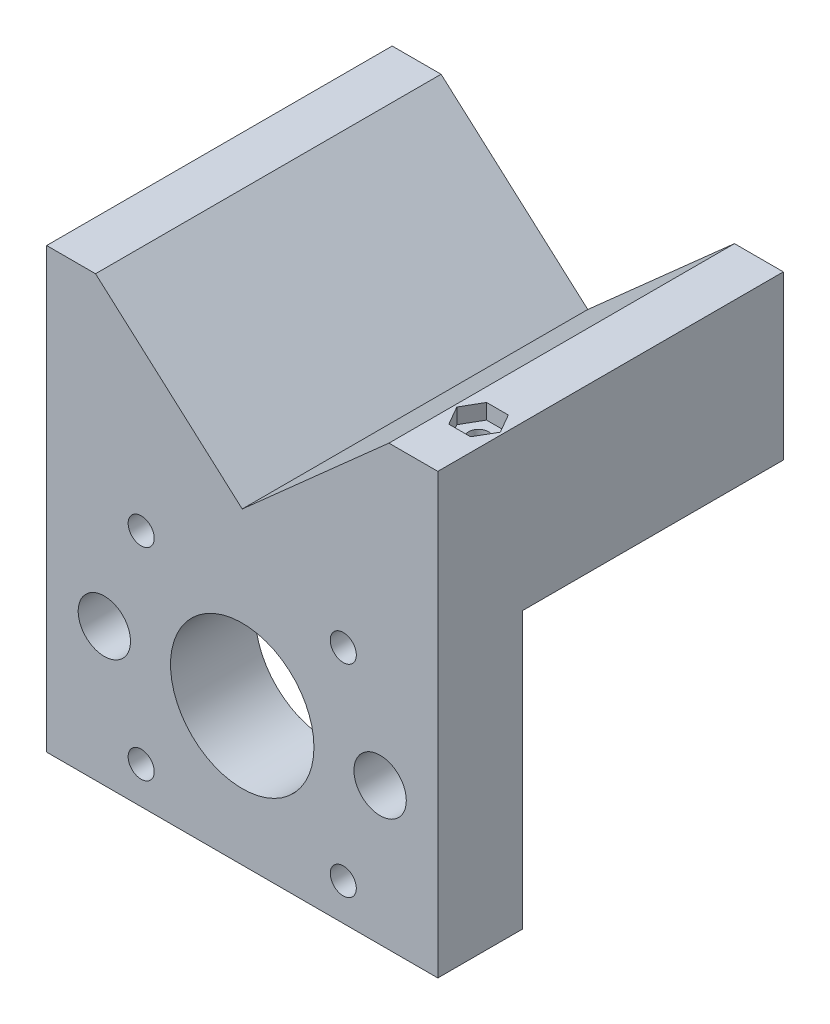
from build123d import *

# Parameters (mm, degrees)
SKETCH2_W           = 60
SKETCH2_H           = 42.3
BOSS_EXTRUDE1_DEPTH = 13
SKETCH4_R           = 11
SKETCH4_R_2         = 2
CUT_EXTRUDE1_DEPTH  = 48.598760453
SKETCH5_R           = 4.015
CUT_EXTRUDE2_DEPTH  = 10
BOSS_EXTRUDE2_DEPTH = 53
CUT_EXTRUDE3_DEPTH  = 2.35
SKETCH8_R           = 1.5
CUT_EXTRUDE4_DEPTH  = 10


with BuildPart() as part:
    # Sketch2 → Boss-Extrude1 (new body)
    with BuildSketch(Plane.XY):
        with Locations((8.969325153, -2.892331288)):
            Rectangle(SKETCH2_W, SKETCH2_H)
    extrude(amount=-BOSS_EXTRUDE1_DEPTH)

    # Sketch4 → Cut-Extrude1 (cut, through all)
    with BuildSketch(Plane.XY):
        with Locations((8.969325153, -2.892331288)):
            Circle(SKETCH4_R)
        with Locations((24.469325153, 12.607668712)):
            Circle(SKETCH4_R_2)
        with Locations((-6.530674847, 12.607668712)):
            Circle(SKETCH4_R_2)
        with Locations((24.469325153, -18.392331288)):
            Circle(SKETCH4_R_2)
        with Locations((-6.530674847, -18.392331288)):
            Circle(SKETCH4_R_2)
    extrude(amount=-CUT_EXTRUDE1_DEPTH, mode=Mode.SUBTRACT)

    # Sketch5 → Cut-Extrude2 (cut)
    with BuildSketch(Plane.XY):
        with Locations((30.119325153, -2.892331288)):
            Circle(SKETCH5_R)
        with Locations(Location((-12.180674847, -2.892331288, 0), (0, 0, 180))):
            Circle(SKETCH5_R)
    extrude(amount=-CUT_EXTRUDE2_DEPTH, mode=Mode.SUBTRACT)

    # Sketch6 → Boss-Extrude2 (add)
    with BuildSketch(Plane.XY):
        Polygon((-21.030674847, 18.257668712), (-21.030674847, 43.257668712), (-13.530674847, 43.257668712), (8.969325153, 23.257668712), (31.469325153, 43.257668712), (38.969325153, 43.257668712), (38.969325153, 18.257668712), align=None)
    extrude(amount=-BOSS_EXTRUDE2_DEPTH)

    # Sketch7 → Cut-Extrude3 (cut)
    with BuildSketch(Plane(origin=(0, 43.257668712, 0), x_dir=(1, 0, 0), z_dir=(0, 1, 0))):
        Polygon((38.559325153, 10), (36.889325153, 12.892524849), (33.549325153, 12.892524849), (31.879325153, 10), (33.549325153, 7.107475151), (36.889325153, 7.107475151), align=None)
    extrude(amount=-CUT_EXTRUDE3_DEPTH, mode=Mode.SUBTRACT)

    # Sketch8 → Cut-Extrude4 (cut)
    with BuildSketch(Plane(origin=(0, 40.907668712, 0), x_dir=(1, 0, 0), z_dir=(0, 1, 0))):
        with Locations(Location((35.219325153, 10, 0), (0, 0, 270))):
            Circle(SKETCH8_R)
    extrude(amount=-CUT_EXTRUDE4_DEPTH, mode=Mode.SUBTRACT)


solid = part.part
